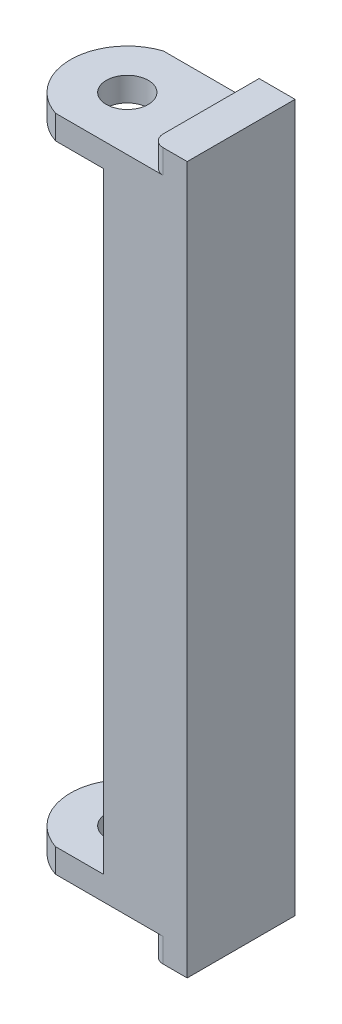
from build123d import *

# Parameters (mm, degrees)
SKETCH1_R           = 1.75
BOSS_EXTRUDE3_DEPTH = 2
BOSS_EXTRUDE4_DEPTH = 25.5
BOSS_EXTRUDE5_DEPTH = 4


with BuildPart() as part:
    # Sketch1 → Boss-Extrude3 (new body)
    with BuildSketch(Plane(origin=(0, 0, 0), x_dir=(1, 0, 0), z_dir=(0, 1, 0))):
        with BuildLine():
            ThreePointArc((-3.991008085, 4.5), (-7.240580672, 0), (-3.991008085, -4.5))
            Line((-3.991008085, -4.5), (7, -4.5))
            Line((7, -4.5), (7, 4.5))
            Line((7, 4.5), (-3.991008085, 4.5))
        make_face()
        with Locations((-2.5, 0)):
            Circle(SKETCH1_R, mode=Mode.SUBTRACT)
    extrude(amount=BOSS_EXTRUDE3_DEPTH)

    # Sketch1<3> → Boss-Extrude4 (add)
    with BuildSketch(Plane(origin=(0, 0, 0), x_dir=(1, 0, 0), z_dir=(0, 1, 0))):
        with BuildLine():
            ThreePointArc((0.004495957, 4.5), (2.65, 0), (0.004495957, -4.5))
            Line((0.004495957, -4.5), (7, -4.5))
            Line((7, -4.5), (7, 4.5))
            Line((7, 4.5), (0.004495957, 4.5))
        make_face()
    extrude(amount=-BOSS_EXTRUDE4_DEPTH)

    # Sketch1<5> → Boss-Extrude5 (add)
    with BuildSketch(Plane(origin=(0, 0, 0), x_dir=(1, 0, 0), z_dir=(0, 1, 0))):
        with BuildLine():
            Line((5.019474666, 4.5), (4, 4.5))
            Line((4, 4.5), (4, -3.5))
            ThreePointArc((4, -3.5), (4.292893219, -4.207106781), (5, -4.5))
            Line((5, -4.5), (7, -4.5))
            Line((7, -4.5), (7, 4.5))
            Line((7, 4.5), (5.019474666, 4.5))
        make_face()
    extrude(amount=BOSS_EXTRUDE5_DEPTH)

    # Mirror1: part across plane


with BuildPart() as part_1:
    add(part.part)
    add(part.part.mirror(Plane.ZX.offset(-25.5)))


solid = part_1.part
